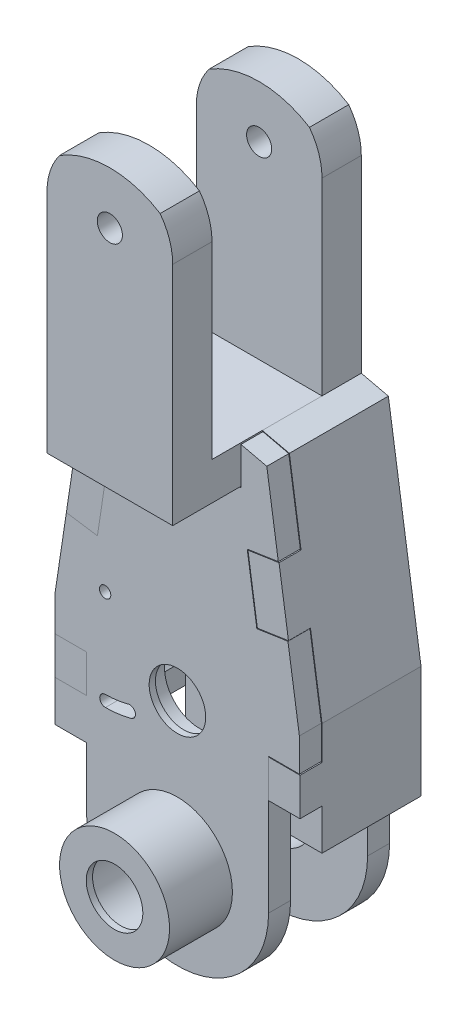
from build123d import *

# Parameters (mm, degrees)
SKETCH1_R           = 4
BOSS_EXTRUDE1_DEPTH = 30
SKETCH1_3_R         = 4
CUT_EXTRUDE1_DEPTH  = 17.5
BOSS_EXTRUDE2_DEPTH = 7
BOSS_EXTRUDE3_DEPTH = 31.5
CUT_EXTRUDE2_DEPTH  = 224.888365039
SKETCH5_R           = 9
CUT_EXTRUDE3_DEPTH  = 224.888365039
SKETCH5_3_R         = 11.1
SKETCH5_3_R_2       = 9
CUT_EXTRUDE4_DEPTH  = 5
SKETCH8_W           = 10
SKETCH8_H           = 12
BOSS_EXTRUDE4_DEPTH = 7
BOSS_EXTRUDE6_DEPTH = 7
SKETCH13_R          = 17.5
BOSS_EXTRUDE7_DEPTH = 20
SKETCH12_R          = 9
CUT_EXTRUDE5_DEPTH  = 220.79365323
CUT_EXTRUDE7_START  = -25
SKETCH12_5_R        = 11.1
SKETCH12_5_R_2      = 9
CUT_EXTRUDE7_DEPTH  = 25
CUT_EXTRUDE8_START  = -5
SKETCH12_6_R        = 11.1
SKETCH12_6_R_2      = 9
CUT_EXTRUDE8_DEPTH  = 5
SKETCH14_R          = 1.8
CUT_EXTRUDE9_DEPTH  = 7
CUT_EXTRUDE10_DEPTH = 24.5


with BuildPart() as part:
    # Sketch1 → Boss-Extrude1 (new, symmetric)
    with BuildSketch(Plane.XY):
        with BuildLine():
            Line((-20, -72), (20, -72))
            Line((20, -72), (20, 0))
            ThreePointArc((20, 0), (18.973665961, 6.32455532), (16, 12))
            ThreePointArc((16, 12), (0, 16.622844919), (-16, 12))
            ThreePointArc((-16, 12), (-18.973665961, 6.32455532), (-20, 0))
            Line((-20, 0), (-20, -72))
        make_face()
        Circle(SKETCH1_R, mode=Mode.SUBTRACT)
    extrude(amount=BOSS_EXTRUDE1_DEPTH, both=True)

    # Sketch1<3> → Cut-Extrude1 (cut, symmetric)
    with BuildSketch(Plane.XY):
        with BuildLine():
            Line((-20, -60), (20, -60))
            Line((20, -60), (20, 0))
            ThreePointArc((20, 0), (18.973665961, 6.32455532), (16, 12))
            ThreePointArc((16, 12), (0, 16.622844919), (-16, 12))
            ThreePointArc((-16, 12), (-18.973665961, 6.32455532), (-20, 0))
            Line((-20, 0), (-20, -60))
        make_face()
        Circle(SKETCH1_3_R, mode=Mode.SUBTRACT)
    extrude(amount=CUT_EXTRUDE1_DEPTH, both=True, mode=Mode.SUBTRACT)

    # Sketch2 → Boss-Extrude2 (add)
    with BuildSketch(Plane(origin=(0, 0, -30), x_dir=(-1, 0, 0), z_dir=(0, 0, -1))):
        with BuildLine():
            Line((-20, -72), (-29, -132))
            Line((-29, -132), (-29, -167))
            Line((-29, -167), (-29, -185))
            ThreePointArc((-29, -185), (0, -214), (29, -185))
            Line((29, -185), (29, -167))
            Line((29, -167), (29, -132))
            Line((29, -132), (20, -72))
            Line((20, -72), (-20, -72))
        make_face()
    extrude(amount=-BOSS_EXTRUDE2_DEPTH)

    # Sketch2<3> → Boss-Extrude3 (add)
    with BuildSketch(Plane(origin=(0, 0, -30), x_dir=(-1, 0, 0), z_dir=(0, 0, -1))):
        Polygon((-29, -167), (-29, -132), (-20, -72), (20, -72), (29, -132), (29, -167), (39, -167), (39, -131.254171946), (28.611874208, -62), (20, -60), (-20, -60), (-28.611874208, -62), (-39, -131.254171946), (-39, -167), align=None)
    extrude(amount=-BOSS_EXTRUDE3_DEPTH)

    # Sketch4 → Cut-Extrude2 (cut, through all)
    with BuildSketch(Plane.XY.offset(-23)):
        with BuildLine():
            Line((-13.7, -112), (-13.7, -105))
            ThreePointArc((-13.7, -105), (-15.5, -103.2), (-17.3, -105))
            Line((-17.3, -105), (-17.3, -112))
            ThreePointArc((-17.3, -112), (-15.5, -113.8), (-13.7, -112))
        make_face()
        with BuildLine():
            Line((17.3, -112), (17.3, -105))
            ThreePointArc((17.3, -105), (15.5, -103.2), (13.7, -105))
            Line((13.7, -105), (13.7, -112))
            ThreePointArc((13.7, -112), (15.5, -113.8), (17.3, -112))
        make_face()
        with BuildLine():
            Line((17.3, -81), (17.3, -74))
            ThreePointArc((17.3, -74), (15.5, -72.2), (13.7, -74))
            Line((13.7, -74), (13.7, -81))
            ThreePointArc((13.7, -81), (15.5, -82.8), (17.3, -81))
        make_face()
        with BuildLine():
            Line((11.1, -96.5), (11.1, -89.5))
            ThreePointArc((11.1, -89.5), (0, -78.4), (-11.1, -89.5))
            Line((-11.1, -89.5), (-11.1, -96.5))
            ThreePointArc((-11.1, -96.5), (0, -107.6), (11.1, -96.5))
        make_face()
        with BuildLine():
            Line((-13.7, -81), (-13.7, -74))
            ThreePointArc((-13.7, -74), (-15.5, -72.2), (-17.3, -74))
            Line((-17.3, -74), (-17.3, -81))
            ThreePointArc((-17.3, -81), (-15.5, -82.8), (-13.7, -81))
        make_face()
    extrude(amount=-CUT_EXTRUDE2_DEPTH, mode=Mode.SUBTRACT)

    # Sketch5 → Cut-Extrude3 (cut, through all)
    with BuildSketch(Plane.XY.offset(-23)):
        with Locations((0, -185)):
            Circle(SKETCH5_R)
        with Locations((0, -141)):
            Circle(SKETCH5_R)
    extrude(amount=-CUT_EXTRUDE3_DEPTH, mode=Mode.SUBTRACT)

    # Sketch5<3> → Cut-Extrude4 (cut)
    # profile 1 of 2: a face of its own
    with BuildSketch(Plane.XY.offset(-23)):
        with Locations((0, -141)):
            Circle(SKETCH5_3_R)
        with Locations((0, -141)):
            Circle(SKETCH5_3_R_2, mode=Mode.SUBTRACT)
    # profile 2 of 2: a face of its own
    with BuildSketch(Plane.XY.offset(-23)):
        with Locations((0, -185)):
            Circle(SKETCH5_3_R)
        with Locations((0, -185)):
            Circle(SKETCH5_3_R_2, mode=Mode.SUBTRACT)
    extrude(amount=-CUT_EXTRUDE4_DEPTH, mode=Mode.SUBTRACT)

    # Sketch8 → Boss-Extrude4 (add)
    with BuildSketch(Plane.XY.offset(1.5)):
        Polygon((-22.43982913, -88.265527531), (-32.329192658, -86.782123002), (-35.329192658, -106.782123002), (-25.43982913, -108.265527531), align=None)
        with Locations((-34, -148)):
            Rectangle(SKETCH8_W, SKETCH8_H)
        with Locations((34, -148)):
            Rectangle(SKETCH8_W, SKETCH8_H)
        Polygon((25.43982913, -108.265527531), (22.43982913, -88.265527531), (32.329192658, -86.782123002), (35.329192658, -106.782123002), align=None)
    extrude(amount=BOSS_EXTRUDE4_DEPTH)

    # Sketch15 → Cut-Extrude10 (cut)
    with BuildSketch(Plane.XY.offset(-23)):
        with BuildLine():
            Line((-29, -145), (-29, -160))
            ThreePointArc((-29, -160), (-31.95326153, -152.5), (-29, -145))
        make_face()
    extrude(amount=CUT_EXTRUDE10_DEPTH, mode=Mode.SUBTRACT)


with BuildPart() as body_2:
    # Sketch11 → Boss-Extrude6 (new body)
    with BuildSketch(Plane.XY.offset(1.5)):
        with BuildLine():
            Line((-39, -142), (-29, -142))
            Line((-29, -142), (-29, -154))
            Line((-29, -154), (-39, -154))
            Line((-39, -154), (-39, -167))
            Line((-39, -167), (-29, -167))
            Line((-29, -167), (-29, -185))
            ThreePointArc((-29, -185), (0, -214), (29, -185))
            Line((29, -185), (29, -141.8))
            Line((29, -141.8), (29.2, -141.8))
            Line((29.2, -141.8), (38.8, -141.8))
            Line((38.8, -141.8), (38.8, -131.269088507))
            Line((38.8, -131.269088507), (35.161073478, -107.009578363))
            Line((35.161073478, -107.009578363), (25.27170995, -108.492982892))
            Line((25.27170995, -108.492982892), (22.212373769, -88.097408351))
            Line((22.212373769, -88.097408351), (32.101737297, -86.614003822))
            Line((32.101737297, -86.614003822), (28.434247372, -62.16407099))
            Line((28.434247372, -62.16407099), (20.2, -60.251770097))
            Line((20.2, -60.251770097), (20.2, -72.2))
            Line((20.2, -72.2), (-20.2, -72.2))
            Line((-20.2, -72.2), (-20.2, -60.251770097))
            Line((-20.2, -60.251770097), (-28.434247372, -62.16407099))
            Line((-28.434247372, -62.16407099), (-32.101737297, -86.614003822))
            Line((-32.101737297, -86.614003822), (-22.410161039, -88.067740261))
            Line((-22.410161039, -88.067740261), (-25.43982913, -108.265527531))
            Line((-25.43982913, -108.265527531), (-35.329192658, -106.782123002))
            Line((-35.329192658, -106.782123002), (-39, -131.254171946))
            Line((-39, -131.254171946), (-39, -142))
        make_face()
    extrude(amount=BOSS_EXTRUDE6_DEPTH)

    # Sketch13 → Boss-Extrude7 (add)
    with BuildSketch(Plane.XY.offset(8.5)):
        with Locations((0, -185)):
            Circle(SKETCH13_R)
    extrude(amount=BOSS_EXTRUDE7_DEPTH)

    # Sketch12 → Cut-Extrude5 (cut, through all)
    with BuildSketch(Plane(origin=(0, 0, 1.5), x_dir=(-1, 0, 0), z_dir=(0, 0, -1))):
        with Locations((0, -185)):
            Circle(SKETCH12_R)
        with Locations((0, -141)):
            Circle(SKETCH12_R)
    extrude(amount=-CUT_EXTRUDE5_DEPTH, mode=Mode.SUBTRACT)

    # Sketch12<5> → Cut-Extrude7 (cut)
    with BuildSketch(Plane(origin=(0, 0, 1.5), x_dir=(-1, 0, 0), z_dir=(0, 0, -1)).offset(CUT_EXTRUDE7_START)):
        with Locations((0, -185)):
            Circle(SKETCH12_5_R)
        with Locations(Location((0, -185, 0), (0, 0, 180))):
            Circle(SKETCH12_5_R_2, mode=Mode.SUBTRACT)
    extrude(amount=CUT_EXTRUDE7_DEPTH, mode=Mode.SUBTRACT)

    # Sketch12<6> → Cut-Extrude8 (cut)
    with BuildSketch(Plane(origin=(0, 0, 1.5), x_dir=(-1, 0, 0), z_dir=(0, 0, -1)).offset(CUT_EXTRUDE8_START)):
        with Locations((0, -141)):
            Circle(SKETCH12_6_R)
        with Locations((0, -141)):
            Circle(SKETCH12_6_R_2, mode=Mode.SUBTRACT)
    extrude(amount=CUT_EXTRUDE8_DEPTH, mode=Mode.SUBTRACT)

    # Sketch14 → Cut-Extrude9 (cut)
    with BuildSketch(Plane.XY.offset(8.5)):
        with BuildLine():
            ThreePointArc((-22.909945843, -154.299872488), (-18.76, -154.016065744), (-14.682601732, -153.193010378))
            ThreePointArc((-14.682601732, -153.193010378), (-13.416057651, -150.984874039), (-15.624193989, -149.718329958))
            ThreePointArc((-15.624193989, -149.718329958), (-19.24, -150.448209245), (-22.920140653, -150.699886923))
            ThreePointArc((-22.920140653, -150.699886923), (-24.715036031, -152.504977111), (-22.909945843, -154.299872488))
        make_face()
        with Locations((-23, -122.5)):
            Circle(SKETCH14_R)
    extrude(amount=-CUT_EXTRUDE9_DEPTH, mode=Mode.SUBTRACT)


solid = Compound([part.part, body_2.part])
